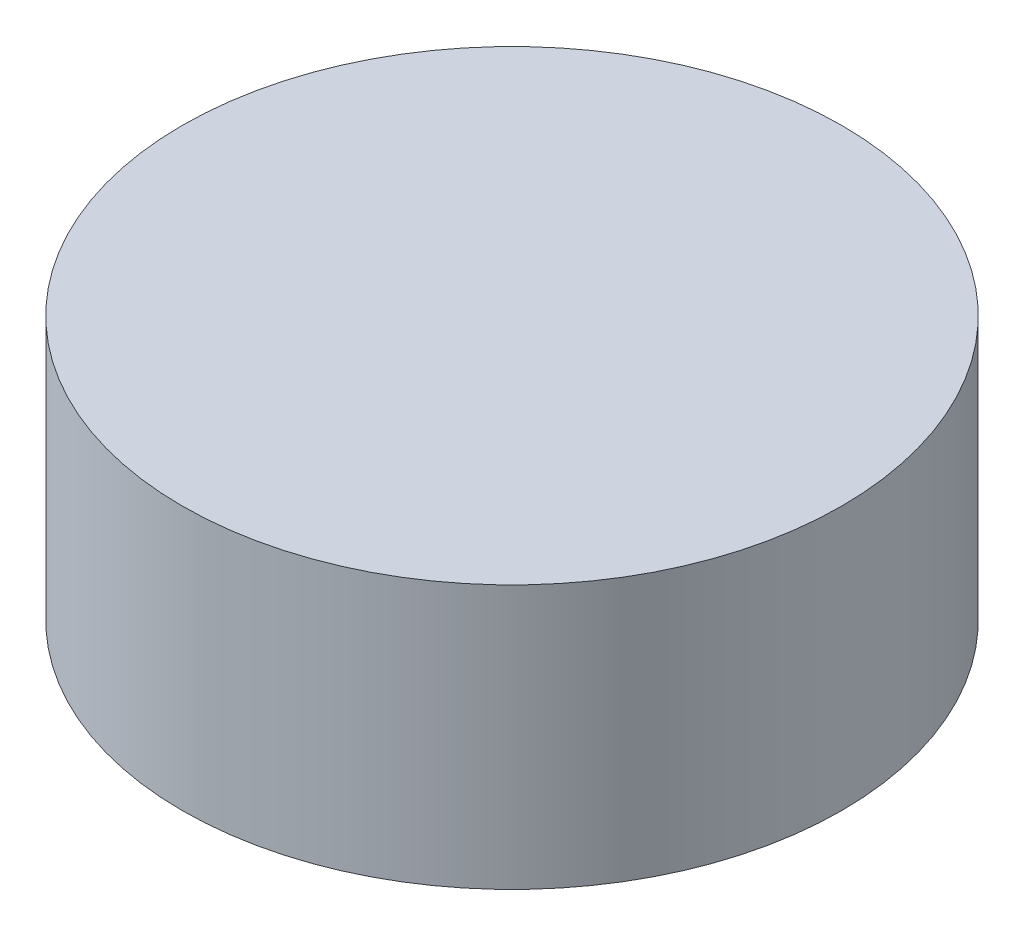
from build123d import *

# Parameters (mm, degrees)
SKETCH1_R           = 2.5
BOSS_EXTRUDE1_DEPTH = 2


with BuildPart() as part:
    # Sketch1 → Boss-Extrude1 (new body)
    with BuildSketch(Plane(origin=(0, 0, 0), x_dir=(1, 0, 0), z_dir=(0, 1, 0))):
        with Locations(Location((0, 0, 0), (0, 0, 270))):
            Circle(SKETCH1_R)
    extrude(amount=BOSS_EXTRUDE1_DEPTH)


solid = part.part
